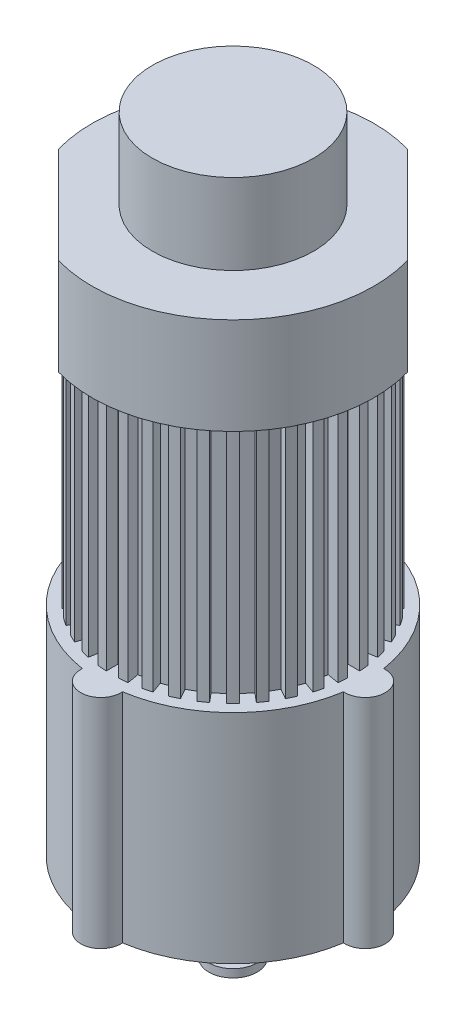
from build123d import *

# Parameters (mm, degrees)
SKETCH_1_R               = 8.2
EXTRUDE_1_DEPTH          = 1
EXTRUDE_2_DEPTH          = 27
SKETCH_3_R               = 15
EXTRUDE_4_DEPTH          = 43
SKETCH_4_R               = 10
EXTRUDE_5_DEPTH          = 10
EXTRUDE_6_DEPTH          = 12
CUT_EXTRUDE_1_DEPTH      = 31
PATTERN_CIRCULAR_1_COUNT = 36
SKETCH_7_R               = 3
EXTRUDE_7_DEPTH          = 10
CUT_EXTRUDE_START        = -5
CUT_EXTRUDE_2_DEPTH      = 5
SKETCH_10_R              = 1.5
CUT_EXTRUDE_3_DEPTH      = 15


with BuildPart() as part:
    # 草图1 → 凸台-拉伸1 (new body)
    with BuildSketch(Plane(origin=(0, 0, 0), x_dir=(1, 0, 0), z_dir=(0, 1, 0))):
        with Locations(Location((0, 0, 0), (0, 0, 270))):
            Circle(SKETCH_1_R)
    extrude(amount=EXTRUDE_1_DEPTH)

    # 草图2 → 凸台-拉伸2 (add)
    with BuildSketch(Plane(origin=(0, 1, 0), x_dir=(1, 0, 0), z_dir=(0, 1, 0))):
        with BuildLine():
            ThreePointArc((16.20945122, -2.492727655), (18.9, 0), (16.20945122, 2.492727655))
            ThreePointArc((16.20945122, 2.492727655), (11.596551211, 11.596551211), (2.492727655, 16.20945122))
            ThreePointArc((2.492727655, 16.20945122), (0, 18.9), (-2.492727655, 16.20945122))
            ThreePointArc((-2.492727655, 16.20945122), (-11.596551211, 11.596551211), (-16.20945122, 2.492727655))
            ThreePointArc((-16.20945122, 2.492727655), (-18.9, 0), (-16.20945122, -2.492727655))
            ThreePointArc((-16.20945122, -2.492727655), (-11.596551211, -11.596551211), (-2.492727655, -16.20945122))
            ThreePointArc((-2.492727655, -16.20945122), (0, -18.9), (2.492727655, -16.20945122))
            ThreePointArc((2.492727655, -16.20945122), (11.596551211, -11.596551211), (16.20945122, -2.492727655))
        make_face()
    extrude(amount=EXTRUDE_2_DEPTH)

    # 草图3 → 凸台-拉伸4 (add)
    with BuildSketch(Plane(origin=(0, 28, 0), x_dir=(1, 0, 0), z_dir=(0, 1, 0))):
        with Locations(Location((0, 0, 0), (0, 0, 270))):
            Circle(SKETCH_3_R)
    extrude(amount=EXTRUDE_4_DEPTH)

    # 草图4 → 凸台-拉伸5 (add)
    with BuildSketch(Plane(origin=(0, 71, 0), x_dir=(1, 0, 0), z_dir=(0, 1, 0))):
        with Locations(Location((0, 0, 0), (0, 0, 270))):
            Circle(SKETCH_4_R)
    extrude(amount=EXTRUDE_5_DEPTH)

    # 草图5 → 凸台-拉伸6 (add)
    with BuildSketch(Plane(origin=(0, 71, 0), x_dir=(1, 0, 0), z_dir=(0, 1, 0))):
        with BuildLine():
            Line((-16.827061466, -4.806246186), (-4.806246186, -16.827061466))
            ThreePointArc((-4.806246186, -16.827061466), (12.374368671, -12.374368671), (16.827061466, 4.806246186))
            Line((16.827061466, 4.806246186), (4.806246186, 16.827061466))
            ThreePointArc((4.806246186, 16.827061466), (0, 17.5), (-4.806246186, 16.827061466))
            ThreePointArc((-4.806246186, 16.827061466), (-15.297058541, 8.5), (-16.827061466, -4.806246186))
        make_face()
    extrude(amount=-EXTRUDE_6_DEPTH)

    # 草图6 → 切除-拉伸1 (cut)
    with BuildSketch(Plane(origin=(0, 28, 0), x_dir=(1, 0, 0), z_dir=(0, 1, 0))):
        with BuildLine():
            ThreePointArc((-14.981238267, 0.75), (-15, 0), (-14.981238267, -0.75))
            Line((-14.981238267, -0.75), (-13.5, -0.75))
            Line((-13.5, -0.75), (-13.5, 0.75))
            Line((-13.5, 0.75), (-14.981238267, 0.75))
        make_face()
    cut_extrude_1 = extrude(amount=CUT_EXTRUDE_1_DEPTH, mode=Mode.SUBTRACT)

    # 阵列(圆周)1: 切除-拉伸1 ×36 about axis
    pattern_circular_1_axis = Axis((0, 0, 0), (0, 1, 0))
    for i in range(1, PATTERN_CIRCULAR_1_COUNT):
        add(cut_extrude_1.rotate(pattern_circular_1_axis, i * 360 / PATTERN_CIRCULAR_1_COUNT), mode=Mode.SUBTRACT)

    # 草图7 → 凸台-拉伸7 (add)
    with BuildSketch(Plane.XZ):
        with Locations(Location((0, 0, 0), (0, 0, 270))):
            Circle(SKETCH_7_R)
    extrude(amount=EXTRUDE_7_DEPTH)

    # 草图9 → 切除-拉伸2 (cut)
    with BuildSketch(Plane(origin=(0, -9, 0), x_dir=(-1, 0, 0), z_dir=(0, -1, 0)).offset(CUT_EXTRUDE_START)):
        with BuildLine():
            ThreePointArc((-3, 0), (-2.121320344, -2.121320344), (0, -3))
            Line((0, -3), (-3, 0))
        make_face()
        with BuildLine():
            ThreePointArc((0, -3), (2.121320344, -2.121320344), (3, 0))
            Line((3, 0), (0, -3))
        make_face()
    extrude(amount=CUT_EXTRUDE_2_DEPTH, mode=Mode.SUBTRACT)

    # 草图10 → 切除-拉伸3 (cut)
    with BuildSketch(Plane.XZ.offset(-1)):
        with Locations(Location((-8.485281374, -8.485281374, 0), (0, 0, 270))):
            Circle(SKETCH_10_R)
        with Locations(Location((-3.105828541, 11.591109915, 0), (0, 0, 270))):
            Circle(SKETCH_10_R)
        with Locations(Location((11.591109915, -3.105828541, 0), (0, 0, 270))):
            Circle(SKETCH_10_R)
    extrude(amount=-CUT_EXTRUDE_3_DEPTH, mode=Mode.SUBTRACT)


solid = part.part
